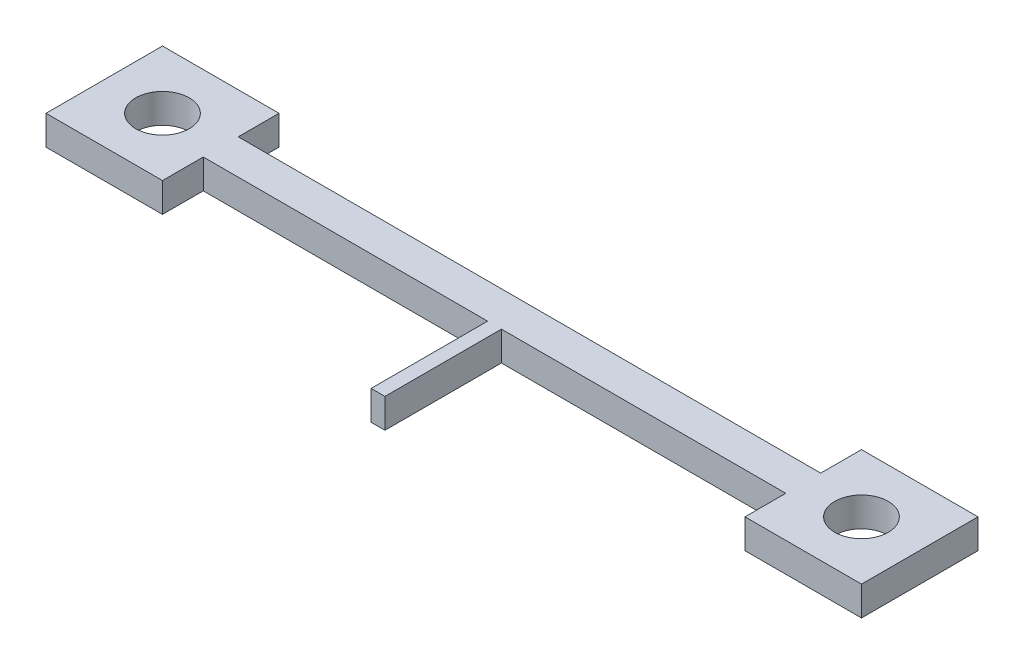
from build123d import *

# Parameters (mm, degrees)
BOSS_EXTRUDE1_DEPTH          = 0.8001
F_97_0_0059_DIAMETER_HOLE1_D = 2.921
SKETCH7_W                    = 0.500000016
SKETCH7_H                    = 1.6002
BOSS_EXTRUDE2_DEPTH          = 6.35
SKETCH11_W                   = 6.35
SKETCH11_H                   = 1.6002
BOSS_EXTRUDE3_DEPTH          = 0.127
SKETCH12_W                   = 6.35
SKETCH12_H                   = 1.6002
BOSS_EXTRUDE4_DEPTH          = 0.127


with BuildPart() as part:
    # Sketch1 → Boss-Extrude1 (new, symmetric)
    with BuildSketch(Plane(origin=(0, 0, 0), x_dir=(1, 0, 0), z_dir=(0, 1, 0))):
        Polygon((-41.424046485, -10.283259465), (-41.424046485, -12.505759465), (-47.774046485, -12.505759465), (-47.774046485, -6.155759465), (-41.424046485, -6.155759465), (-41.424046485, -8.378259465), (-9.674046485, -8.378259465), (-9.674046485, -6.155759465), (-3.324046485, -6.155759465), (-3.324046485, -12.505759465), (-9.674046485, -12.505759465), (-9.674046485, -10.283259465), align=None)
    extrude(amount=BOSS_EXTRUDE1_DEPTH, both=True)

    # #97 (0.0059) Diameter Hole1 (through all)
    with Locations(Plane(origin=(0, 0.8001, 0), x_dir=(-1, 0, 0), z_dir=(0, 1, 0))):
        with Locations((44.599046485, 9.330759465)):
            f_97_0_0059_diameter_hole1 = Hole(F_97_0_0059_DIAMETER_HOLE1_D / 2)

    # Mirror1: #97 (0.0059) Diameter Hole1 across plane
    add(f_97_0_0059_diameter_hole1.mirror(Plane(origin=(-25.549046485, 0, 0), x_dir=(0, 0, 1), z_dir=(1, 0, 0))), mode=Mode.SUBTRACT)

    # Sketch7 → Boss-Extrude2 (add)
    with BuildSketch(Plane.XY.offset(10.283259465)):
        with Locations((-25.549046485, 0)):
            Rectangle(SKETCH7_W, SKETCH7_H)
    extrude(amount=BOSS_EXTRUDE2_DEPTH)

    # Sketch11 → Boss-Extrude3 (add)
    with BuildSketch(Plane.ZY.offset(25.799046493)):
        with Locations((13.458259465, 0)):
            Rectangle(SKETCH11_W, SKETCH11_H)
    extrude(amount=BOSS_EXTRUDE3_DEPTH)

    # Sketch12 → Boss-Extrude4 (add)
    with BuildSketch(Plane(origin=(-25.299046477, 0, 0), x_dir=(0, 0, -1), z_dir=(1, 0, 0))):
        with Locations((-13.458259465, 0)):
            Rectangle(SKETCH12_W, SKETCH12_H)
    extrude(amount=BOSS_EXTRUDE4_DEPTH)


solid = part.part
